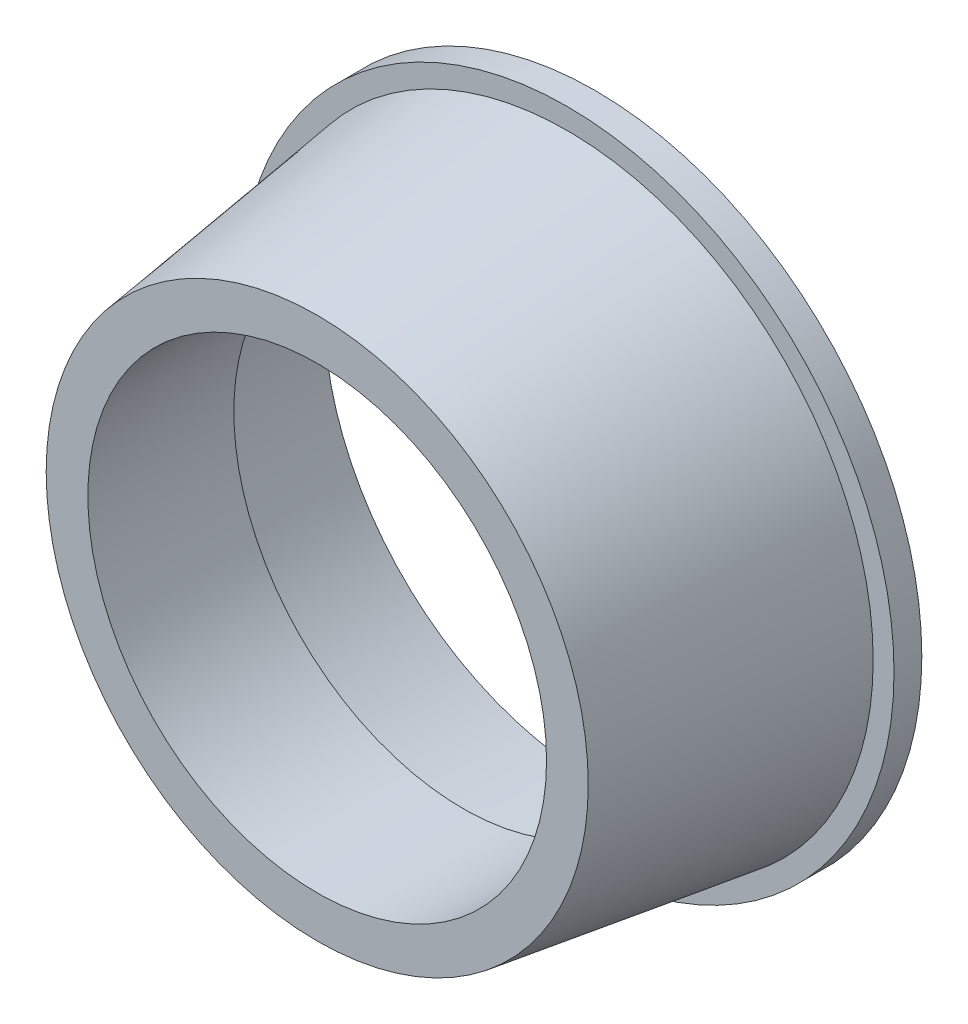
from build123d import *


with BuildPart() as part:
    # Sketch1 → Revolve1 (revolve)
    with BuildSketch(Plane(origin=(0, 0, 0), x_dir=(-1, 0, 0), z_dir=(0, 1, 0)), mode=Mode.PRIVATE) as revolve1_sk:
        Polygon((19.5, 0), (19.25, 8), (16.5, 9.5), (16.5, 20), (19.5, 20), (22, 2), (23.5, 2), (23.5, 0), align=None)
    revolve(revolve1_sk.sketch.rotate(Axis((0, 0, 20), (0, 0, -1)), 180), axis=Axis((0, 0, 20), (0, 0, -1)))


solid = part.part
